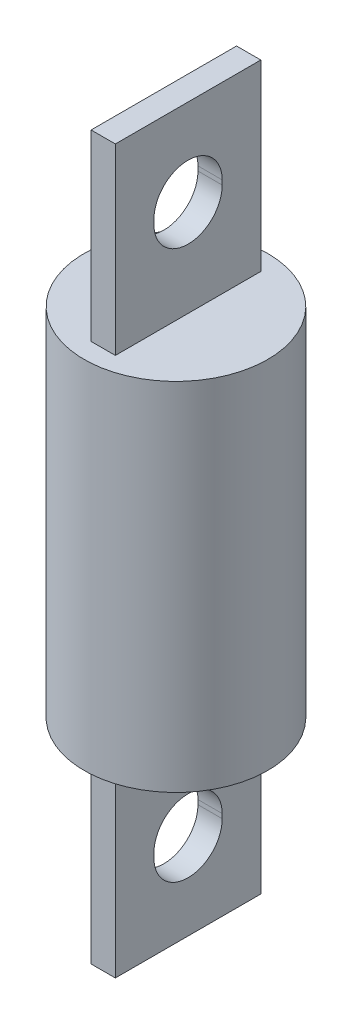
from build123d import *

# Parameters (mm, degrees)
SKETCH1_R           = 12.0269
BOSS_EXTRUDE1_DEPTH = 23.3172
SKETCH3_W           = 3.175
SKETCH3_H           = 19.05
BOSS_EXTRUDE3_DEPTH = 23.9903
CUT_EXTRUDE1_DEPTH  = 10


with BuildPart() as part:
    # Sketch1 → Boss-Extrude1 (new, symmetric)
    with BuildSketch(Plane(origin=(0, 0, 0), x_dir=(1, 0, 0), z_dir=(0, 1, 0))):
        with Locations(Location((0, 0, 0), (0, 0, 90))):
            Circle(SKETCH1_R)
    extrude(amount=BOSS_EXTRUDE1_DEPTH, both=True)

    # Sketch3 → Boss-Extrude3 (add)
    with BuildSketch(Plane(origin=(0, 23.3172, 0), x_dir=(1, 0, 0), z_dir=(0, 1, 0))):
        Rectangle(SKETCH3_W, SKETCH3_H)
    boss_extrude3 = extrude(amount=BOSS_EXTRUDE3_DEPTH)

    # Sketch4 → Cut-Extrude1 (cut)
    with BuildSketch(Plane(origin=(1.5875, 0, 0), x_dir=(0, 0, -1), z_dir=(1, 0, 0))):
        with BuildLine():
            Line((4.4704, 36.2331), (4.4704, 35.6489))
            ThreePointArc((4.4704, 35.6489), (0, 31.1785), (-4.4704, 35.6489))
            Line((-4.4704, 35.6489), (-4.4704, 36.2331))
            ThreePointArc((-4.4704, 36.2331), (0, 40.7035), (4.4704, 36.2331))
        make_face()
        with BuildLine():
            Line((4.4704, -36.2331), (4.4704, -35.6489))
            ThreePointArc((4.4704, -35.6489), (0, -31.1785), (-4.4704, -35.6489))
            Line((-4.4704, -35.6489), (-4.4704, -36.2331))
            ThreePointArc((-4.4704, -36.2331), (0, -40.7035), (4.4704, -36.2331))
        make_face()
    cut_extrude1 = extrude(amount=-CUT_EXTRUDE1_DEPTH, mode=Mode.SUBTRACT)

    # Mirror1: Boss-Extrude3, Cut-Extrude1 across plane
    add(boss_extrude3.mirror(Plane.ZX))
    add(cut_extrude1.mirror(Plane.ZX), mode=Mode.SUBTRACT)


solid = part.part
